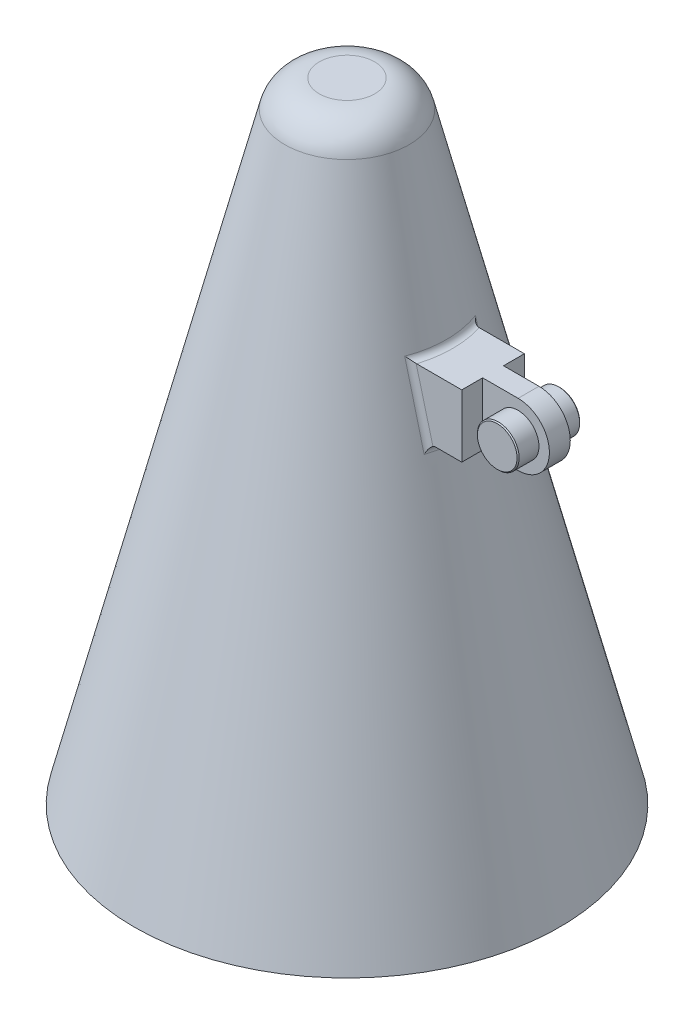
from build123d import *

# Parameters (mm, degrees)
BOSS_EXTRUDE1_REACH = 406.646
BOSS_EXTRUDE1_START = 70
SKETCH3_W           = 30
SKETCH3_H           = 30
BOSS_EXTRUDE2_DEPTH = 5
SKETCH5_R           = 10
BOSS_EXTRUDE3_DEPTH = 15
FILLET1_R           = 3
CHAMFER1_SIZE       = 0.5


with BuildPart() as part:
    # Sketch2 → Revolve-Thin1 (revolve)
    with BuildSketch(Plane.XY, mode=Mode.PRIVATE) as revolve_thin1_sk:
        with BuildLine():
            Line((0, 300), (-13.288353904, 300))
            ThreePointArc((-13.288353904, 300), (-22.519537045, 296.82308157), (-27.840491406, 288.638034376))
            Line((-27.840491406, 288.638034376), (-100, 0))
            Line((-100, 0), (-101.940285, 0.48507125))
            Line((-101.940285, 0.48507125), (-29.780776406, 289.123105626))
            ThreePointArc((-29.780776406, 289.123105626), (-23.750361464, 298.399492446), (-13.288353904, 302))
            Line((-13.288353904, 302), (0, 302))
            Line((0, 302), (0, 300))
        make_face()
    revolve(revolve_thin1_sk.sketch.rotate(Axis((0, 0, 0), (0, 1, 0)), 270), axis=Axis((0, 0, 0), (0, 1, 0)))

    # Sketch3 → Boss-Extrude1 (add, up to next)
    with BuildSketch(Plane(origin=(0, 0, 0), x_dir=(0, 0, -1), z_dir=(1, 0, 0)).offset(BOSS_EXTRUDE1_START), mode=Mode.PRIVATE) as boss_extrude1_sk1:
        with Locations((0, 200)):
            Rectangle(SKETCH3_W, SKETCH3_H)
    boss_extrude1_tool1 = extrude(boss_extrude1_sk1.sketch, amount=-BOSS_EXTRUDE1_REACH, mode=Mode.PRIVATE) - part.part
    add(boss_extrude1_tool1.solids().sort_by_distance((70, 200, 0))[0])

    # Sketch4 → Boss-Extrude2 (add, symmetric)
    with BuildSketch(Plane.XY):
        with BuildLine():
            Line((70, 215), (87, 215))
            ThreePointArc((87, 215), (102, 200), (87, 185))
            Line((87, 185), (70, 185))
            Line((70, 185), (70, 215))
        make_face()
    extrude(amount=BOSS_EXTRUDE2_DEPTH, both=True)

    # Sketch5 → Boss-Extrude3 (add, symmetric)
    with BuildSketch(Plane.XY):
        with Locations(Location((87, 200, 0), (0, 0, 180))):
            Circle(SKETCH5_R)
    extrude(amount=BOSS_EXTRUDE3_DEPTH, both=True)

    # Fillet1
    fillet1_edges = [part.edges().sort_by_distance(p)[0] for p in [
        (48.311552813, 215, 0),
        (49.853019013, 200.003141557, -15),
        (49.853019013, 200.003141557, 15),
        (55.811552813, 185, 0),
    ]]
    fillet(fillet1_edges, radius=FILLET1_R)

    # Chamfer1
    chamfer1_edges = [part.edges().sort_by_distance(p)[0] for p in [
        (97, 200, -15),
        (97, 200, 15),
    ]]
    chamfer(chamfer1_edges, length=CHAMFER1_SIZE)


solid = part.part
